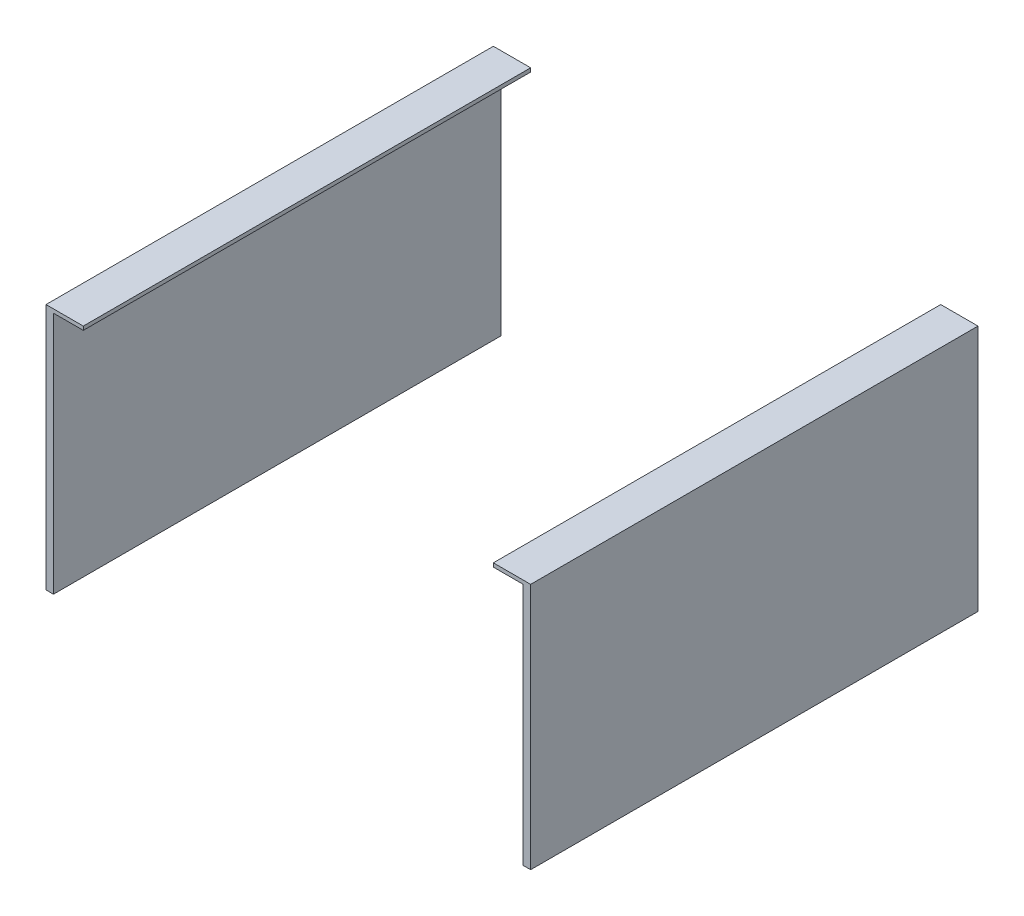
from build123d import *

# Parameters (mm, degrees)
SKETCH_1_W          = 130
SKETCH_1_H          = 120
EXTRUDE_2_DEPTH     = 66.3
SKETCH_3_W          = 126
SKETCH_3_H          = 65.3
CUT_EXTRUDE_1_DEPTH = 136.3
SKETCH_4_W          = 110
SKETCH_4_H          = 120
CUT_EXTRUDE_2_DEPTH = 136.3


with BuildPart() as part:
    # 스케치1 → 보스-돌출2 (new body)
    with BuildSketch(Plane(origin=(0, 0, 0), x_dir=(1, 0, 0), z_dir=(0, 1, 0))):
        Rectangle(SKETCH_1_W, SKETCH_1_H)
    extrude(amount=EXTRUDE_2_DEPTH)

    # 스케치3 → 컷-돌출1 (cut)
    with BuildSketch(Plane.XY.offset(60)):
        with Locations((0, 32.65)):
            Rectangle(SKETCH_3_W, SKETCH_3_H)
    extrude(amount=-CUT_EXTRUDE_1_DEPTH, mode=Mode.SUBTRACT)

    # 스케치4 → 컷-돌출2 (cut)
    with BuildSketch(Plane(origin=(0, 66.3, 0), x_dir=(1, 0, 0), z_dir=(0, 1, 0))):
        Rectangle(SKETCH_4_W, SKETCH_4_H)
    extrude(amount=-CUT_EXTRUDE_2_DEPTH, mode=Mode.SUBTRACT)


with BuildPart() as cut_extrude_2_piece_1:
    # of the separate pieces the step leaves, piece 1, a body of its own (cut_extrude_2_pieces)
    add(part.part.solids().sort_by_distance((-65, 0, 60))[0])


with BuildPart() as cut_extrude_2_piece_2:
    # of the separate pieces the step leaves, piece 2, a body of its own (cut_extrude_2_pieces)
    add(part.part.solids().sort_by_distance((55, 66.3, 60))[0])


solid = Compound([cut_extrude_2_piece_1.part, cut_extrude_2_piece_2.part])
